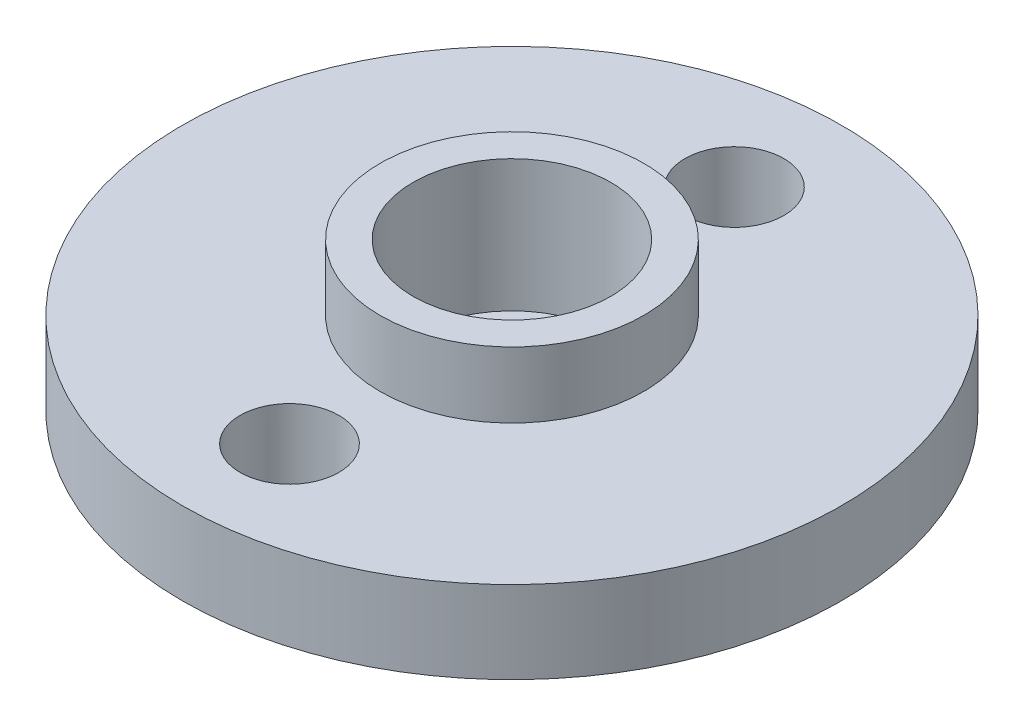
from build123d import *

# Parameters (mm, degrees)
SKETCH4_R          = 1.5
CUT_EXTRUDE1_DEPTH = 15.361406616
CIRPATTERN1_COUNT  = 4


with BuildPart() as part:
    # Sketch1 → Revolve1 (revolve)
    with BuildSketch(Plane.XY, mode=Mode.PRIVATE) as revolve1_sk:
        Polygon((3, 0), (4, 0), (4, -2), (10, -2), (10, -4.5), (1.5, -4.5), (1.5, -4), (3, -4), align=None)
    revolve(revolve1_sk.sketch.rotate(Axis((0, 3.424478083, 0), (0, -1, 0)), 90), axis=Axis((0, 3.424478083, 0), (0, -1, 0)))

    # Sketch4 → Cut-Extrude1 (cut, through all)
    with BuildSketch(Plane(origin=(0, -2, 0), x_dir=(1, 0, 0), z_dir=(0, 1, 0))):
        with Locations(Location((0, 6.75, 0), (0, 0, 270))):
            Circle(SKETCH4_R)
    cut_extrude1 = extrude(amount=-CUT_EXTRUDE1_DEPTH, mode=Mode.SUBTRACT)

    # CirPattern1: Cut-Extrude1 ×4 about axis
    cirpattern1_axis = Axis((-7.809580464, -4.5, 0), (1, 0, 0))
    for i in range(1, CIRPATTERN1_COUNT):
        add(cut_extrude1.rotate(cirpattern1_axis, i * 360 / CIRPATTERN1_COUNT), mode=Mode.SUBTRACT)


solid = part.part
